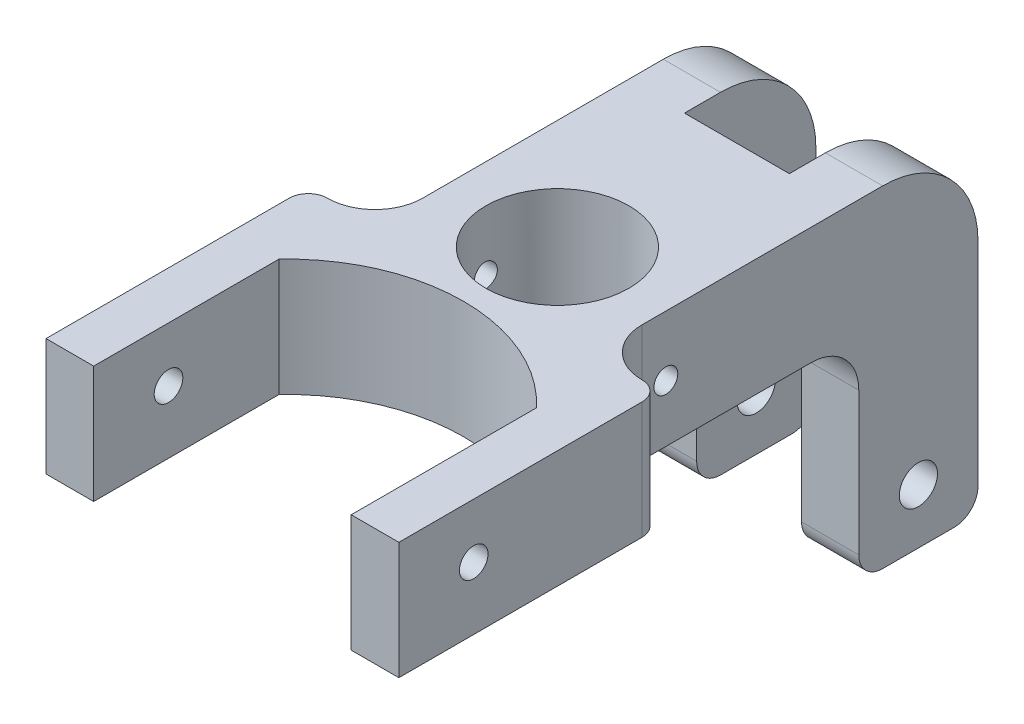
from build123d import *

# Parameters (mm, degrees)
EXTRUDE_START         = -3
EXTRUDE_1_DEPTH       = 46
SKETCH_2_R            = 15
SKETCH_2_W            = 22
SKETCH_2_H            = 41.003909118
CUT_EXTRUDE_2_DEPTH   = 85
SKETCH_3_R            = 4
SKETCH_3_R_2          = 2.5
CUT_EXTRUDE_1_DEPTH   = 55
SKETCH_4_W            = 74
SKETCH_4_H            = 24.59688775
EXTRUDE_3_DEPTH       = 55
CUT_EXTRUDE_2_2_DEPTH = 50
FILLET_2_R            = 4
SKETCH_7_R            = 3
CUT_EXTRUDE_3_DEPTH   = 90
FILLET_3_R            = 10


with BuildPart() as part:
    # Эскиз1 → Вытянуть1 (new body)
    with BuildSketch(Plane(origin=(0, 0, 0), x_dir=(0, 0, -1), z_dir=(1, 0, 0)).offset(EXTRUDE_START)):
        with BuildLine():
            Line((3.683652722, 0), (3.683652722, -24.59688775))
            Line((3.683652722, -24.59688775), (49.132150834, -24.59688775))
            ThreePointArc((49.132150834, -24.59688775), (56.203218646, -27.525819938), (59.132150834, -34.59688775))
            Line((59.132150834, -34.59688775), (59.132150834, -64.518198086))
            ThreePointArc((59.132150834, -64.518198086), (60.596616928, -68.053731992), (64.132150834, -69.518198086))
            Line((64.132150834, -69.518198086), (79.132150834, -69.518198086))
            ThreePointArc((79.132150834, -69.518198086), (82.66768474, -68.053731992), (84.132150834, -64.518198086))
            Line((84.132150834, -64.518198086), (84.132150834, -20))
            ThreePointArc((84.132150834, -20), (78.274286458, -5.857864376), (64.132150834, 0))
            Line((64.132150834, 0), (3.683652722, 0))
        make_face()
    extrude(amount=EXTRUDE_1_DEPTH)

    # Эскиз2 → Cut-Extrude 2 (cut, symmetric)
    with BuildSketch(Plane(origin=(0, 0, 0), x_dir=(1, 0, 0), z_dir=(0, 1, 0))):
        with Locations(Location((20, 18.931682227, 0), (0, 0, 270))):
            Circle(SKETCH_2_R)
        with Locations((20, 77.079487522)):
            Rectangle(SKETCH_2_W, SKETCH_2_H)
    extrude(amount=CUT_EXTRUDE_2_DEPTH, both=True, mode=Mode.SUBTRACT)

    # Эскиз3 → Вырез-Вытянуть1 (cut, symmetric)
    with BuildSketch(Plane(origin=(0, 0, 0), x_dir=(0, 0, -1), z_dir=(1, 0, 0))):
        with Locations((71.632150834, -58)):
            Circle(SKETCH_3_R)
        with Locations((18.675004926, -12.628238718)):
            Circle(SKETCH_3_R_2)
    extrude(amount=CUT_EXTRUDE_1_DEPTH, both=True, mode=Mode.SUBTRACT)

    # Эскиз4 → Вытянуть3 (add)
    with BuildSketch(Plane.XY.offset(-3.683652722)):
        with Locations((20.00338787, -12.298443875)):
            Rectangle(SKETCH_4_W, SKETCH_4_H)
    extrude(amount=EXTRUDE_3_DEPTH)

    # Эскиз6 → Cut-Extrude 2 2 (cut, symmetric)
    with BuildSketch(Plane(origin=(0, 0, 0), x_dir=(1, 0, 0), z_dir=(0, 1, 0))):
        with BuildLine():
            Line((47.00338787, -53.713591308), (47.00338787, -12.467045061))
            ThreePointArc((47.00338787, -12.467045061), (20.003387867, -0.765266351), (-6.99661213, -12.467045078))
            Line((-6.99661213, -12.467045078), (-6.99661213, -53.713591308))
            Line((-6.99661213, -53.713591308), (47.00338787, -53.713591308))
        make_face()
    extrude(amount=CUT_EXTRUDE_2_2_DEPTH, both=True, mode=Mode.SUBTRACT)

    # Скругление2
    fillet_2_edges = [part.edges().sort_by_distance(p)[0] for p in [
        (57.00338787, -12.298443875, -3.683652722),
        (-16.99661213, -12.298443875, -3.683652722),
    ]]
    fillet(fillet_2_edges, radius=FILLET_2_R)

    # Эскиз7 → Вырез-Вытянуть3 (cut, symmetric)
    with BuildSketch(Plane(origin=(57.00338787, 0, 0), x_dir=(0, 0, -1), z_dir=(1, 0, 0))):
        with Locations((-35.623538585, -11.460561108)):
            Circle(SKETCH_7_R)
    extrude(amount=CUT_EXTRUDE_3_DEPTH, both=True, mode=Mode.SUBTRACT)

    # Скругление3
    fillet_3_edges = [part.edges().sort_by_distance(p)[0] for p in [
        (-3, -12.298443875, -3.683652722),
        (43, -12.298443875, -3.683652722),
    ]]
    fillet(fillet_3_edges, radius=FILLET_3_R)


solid = part.part
